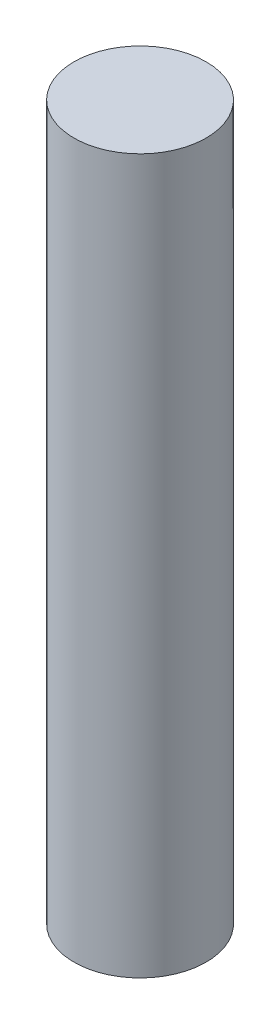
from build123d import *

# Parameters (mm, degrees)
SKETCH1_R           = 2
BOSS_EXTRUDE1_DEPTH = 21.6


with BuildPart() as part:
    # Sketch1 → Boss-Extrude1 (new body)
    with BuildSketch(Plane(origin=(0, 0, 0), x_dir=(1, 0, 0), z_dir=(0, 1, 0))):
        with Locations(Location((0, 0, 0), (0, 0, 90))):
            Circle(SKETCH1_R)
    extrude(amount=BOSS_EXTRUDE1_DEPTH)


solid = part.part
